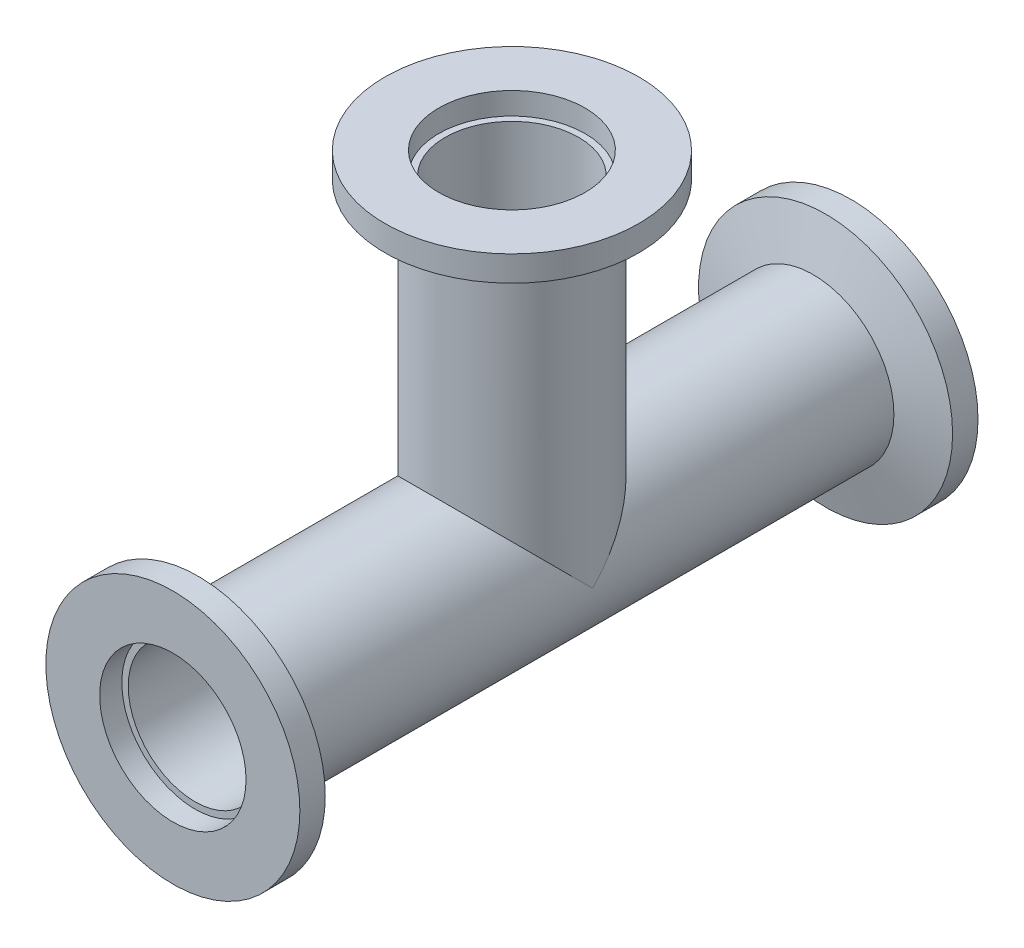
from build123d import *

# Parameters (mm, degrees)
CUT_EXTRUDE1_DEPTH      = 51.803373325
CUT_EXTRUDE1_DEPTH_BACK = 51.803373325
SKETCH4_R               = 7.874
CUT_EXTRUDE2_START      = -12.5095
SKETCH5_R               = 7.874
CUT_EXTRUDE2_DEPTH      = 64.312873325


with BuildPart() as part:
    # Sketch2 → Revolve1 (revolve)
    with BuildSketch(Plane(origin=(0, 0, 0), x_dir=(0, 0, -1), z_dir=(1, 0, 0)), mode=Mode.PRIVATE) as revolve1_sk:
        Polygon((-40.005, 2.4765), (-37.0078, 2.4765), (-35.54452946, -2.9845), (35.54452946, -2.9845), (37.0078, 2.4765), (40.005, 2.4765), (40.005, -3.8735), (37.3888, -3.8735), (37.3888, -12.5095), (-37.3888, -12.5095), (-37.3888, -3.8735), (-40.005, -3.8735), align=None)
    revolve(revolve1_sk.sketch.rotate(Axis((0, -12.5095, 40.005), (0, 0, -1)), 90), axis=Axis((0, -12.5095, 40.005), (0, 0, -1)))

    # Sketch3 → Revolve2 (revolve)
    with BuildSketch(Plane(origin=(0, 0, 0), x_dir=(0, 0, -1), z_dir=(1, 0, 0)), mode=Mode.PRIVATE) as revolve2_sk:
        Polygon((-14.986, 27.4955), (-14.986, 24.4983), (-9.525, 23.03502946), (-9.525, -12.5095), (0, -12.5095), (0, 24.8793), (-8.636, 24.8793), (-8.636, 27.4955), align=None)
    revolve(revolve2_sk.sketch.rotate(Axis((0, -12.5095, 0), (0, 1, 0)), 180), axis=Axis((0, -12.5095, 0), (0, 1, 0)))

    # Sketch4 → Cut-Extrude1 (cut, two sides: drawn at the far end of the back side and taken through both)
    with BuildSketch(Plane.XY.offset(-CUT_EXTRUDE1_DEPTH_BACK)):
        with Locations((0, -12.5095)):
            Circle(SKETCH4_R)
    extrude(amount=CUT_EXTRUDE1_DEPTH + CUT_EXTRUDE1_DEPTH_BACK, mode=Mode.SUBTRACT)

    # Sketch5 → Cut-Extrude2 (cut, through all)
    with BuildSketch(Plane(origin=(0, 0, 0), x_dir=(1, 0, 0), z_dir=(0, 1, 0)).offset(CUT_EXTRUDE2_START)):
        with Locations(Location((0, 0, 0), (0, 0, 90))):
            Circle(SKETCH5_R)
    extrude(amount=CUT_EXTRUDE2_DEPTH, mode=Mode.SUBTRACT)


solid = part.part
